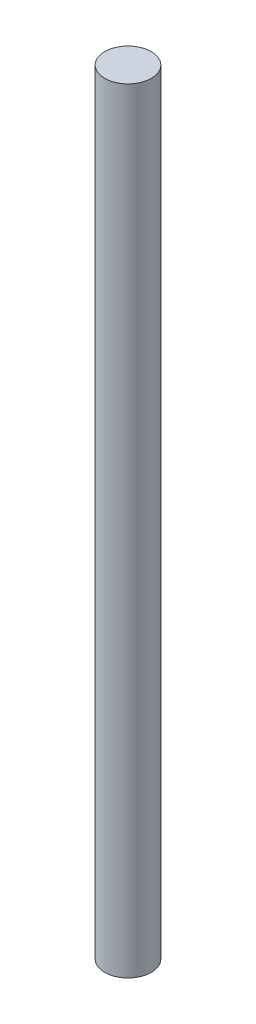
from build123d import *

# Parameters (mm, degrees)
SKETCH_1_R      = 2.1
EXTRUDE_1_DEPTH = 70


with BuildPart() as part:
    # 草图1 → 凸台-拉伸1 (new body)
    with BuildSketch(Plane(origin=(0, 0, 0), x_dir=(1, 0, 0), z_dir=(0, 1, 0))):
        with Locations(Location((0, 0, 0), (0, 0, 270))):
            Circle(SKETCH_1_R)
    extrude(amount=EXTRUDE_1_DEPTH)


solid = part.part
